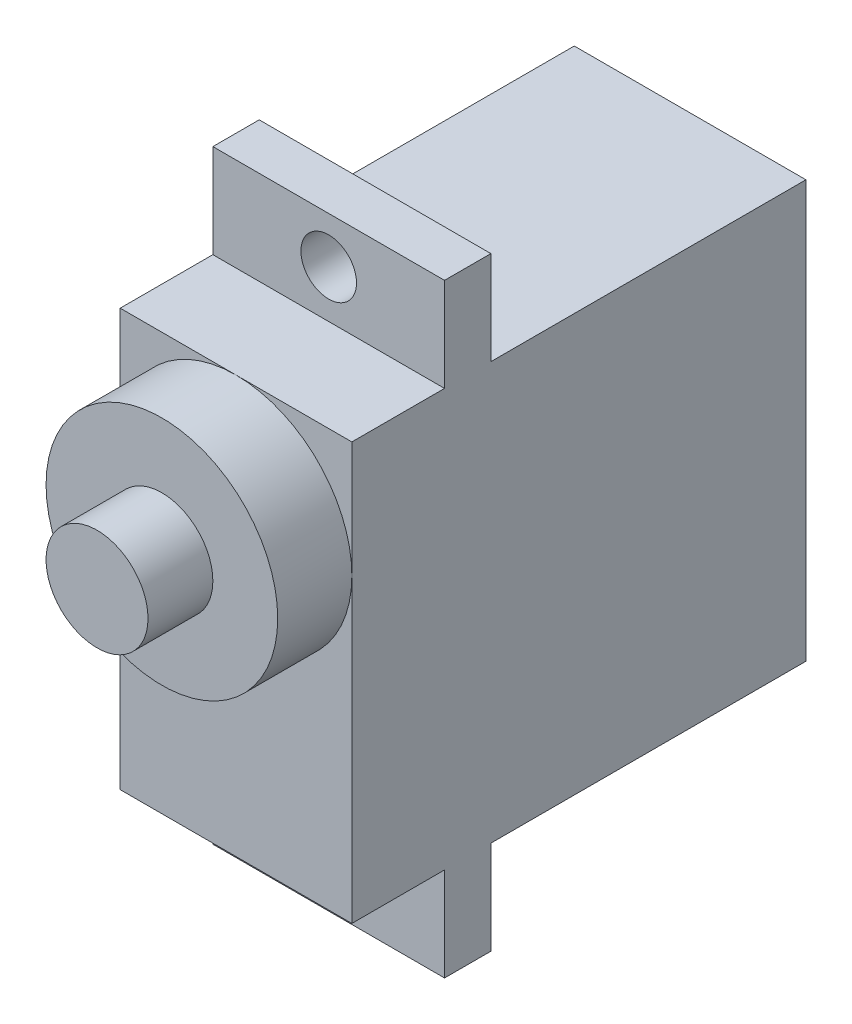
from build123d import *

# Parameters (mm, degrees)
SKETCH_1_W          = 12.5
SKETCH_1_H          = 22.5
EXTRUDE_1_DEPTH     = 24.5
SKETCH_1_3_W        = 12.5
SKETCH_1_3_H        = 5.05
SKETCH_1_3_R        = 1.5
EXTRUDE_2_DEPTH     = 19.5
SKETCH_1_4_W        = 12.5
SKETCH_1_4_H        = 5.05
SKETCH_1_4_R        = 1.5
CUT_EXTRUDE_1_DEPTH = 17
SKETCH_1_5_R        = 6.25
EXTRUDE_3_DEPTH     = 28.5
SKETCH_1_6_R        = 2.75
EXTRUDE_4_DEPTH     = 32


with BuildPart() as part:
    # 草图1 → 凸台-拉伸1 (new body)
    with BuildSketch(Plane.XY):
        Rectangle(SKETCH_1_W, SKETCH_1_H)
    extrude(amount=EXTRUDE_1_DEPTH)

    # 草图1<3> → 凸台-拉伸2 (add)
    # profile 1 of 2: a face of its own
    with BuildSketch(Plane.XY):
        with Locations((0, -13.775)):
            Rectangle(SKETCH_1_3_W, SKETCH_1_3_H)
        with Locations((0, -13.8)):
            Circle(SKETCH_1_3_R, mode=Mode.SUBTRACT)
    # profile 2 of 2: a face of its own
    with BuildSketch(Plane.XY):
        with Locations((0, 13.775)):
            Rectangle(SKETCH_1_3_W, SKETCH_1_3_H)
        with Locations((0, 13.8)):
            Circle(SKETCH_1_3_R, mode=Mode.SUBTRACT)
    extrude(amount=EXTRUDE_2_DEPTH)

    # 草图1<4> → 切除-拉伸1 (cut)
    # profile 1 of 2: a face of its own
    with BuildSketch(Plane.XY):
        with Locations((0, -13.775)):
            Rectangle(SKETCH_1_4_W, SKETCH_1_4_H)
        with Locations((0, -13.8)):
            Circle(SKETCH_1_4_R, mode=Mode.SUBTRACT)
    # profile 2 of 2: a face of its own
    with BuildSketch(Plane.XY):
        with Locations((0, 13.775)):
            Rectangle(SKETCH_1_4_W, SKETCH_1_4_H)
        with Locations((0, 13.8)):
            Circle(SKETCH_1_4_R, mode=Mode.SUBTRACT)
    extrude(amount=CUT_EXTRUDE_1_DEPTH, mode=Mode.SUBTRACT)

    # 草图1<5> → 凸台-拉伸3 (add)
    with BuildSketch(Plane.XY):
        with Locations((0, 5)):
            Circle(SKETCH_1_5_R)
    extrude(amount=EXTRUDE_3_DEPTH)

    # 草图1<6> → 凸台-拉伸4 (add)
    with BuildSketch(Plane.XY):
        with Locations((0, 5)):
            Circle(SKETCH_1_6_R)
    extrude(amount=EXTRUDE_4_DEPTH)


solid = part.part
